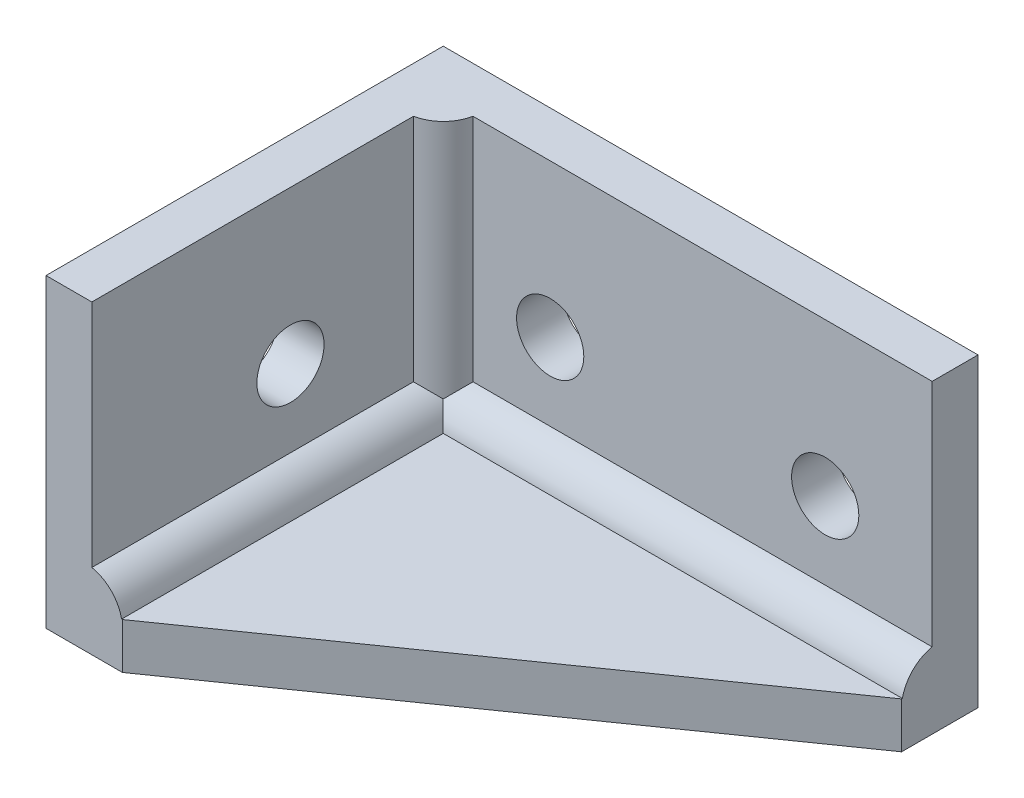
from build123d import *

# Parameters (mm, degrees)
BOSS_EXTRUDE1_DEPTH      = 20
CUT_EXTRUDE1_DEPTH       = 17
BOSS_EXTRUDE2_REACH      = 49.969
SKETCH3_R                = 2.5
BOSS_EXTRUDE3_REACH      = 49.969
BOSS_EXTRUDE3_END_RADIUS = 2.5
SKETCH4_R                = 2.5
BOSS_EXTRUDE4_REACH      = 49.969
SKETCH5_R                = 2.5
SKETCH6_R                = 2.2
CUT_EXTRUDE2_DEPTH       = 47.411205543
SKETCH7_R                = 2.2
CUT_EXTRUDE3_DEPTH       = 46.82575695


with BuildPart() as part:
    # Sketch1 → Boss-Extrude1 (new body)
    with BuildSketch(Plane(origin=(0, 0, 0), x_dir=(1, 0, 0), z_dir=(0, 1, 0))):
        Polygon((0, 0), (35, 0), (35, -5), (5, -26), (0, -26), align=None)
    extrude(amount=BOSS_EXTRUDE1_DEPTH)

    # Sketch2 → Cut-Extrude1 (cut)
    with BuildSketch(Plane(origin=(0, 20, 0), x_dir=(1, 0, 0), z_dir=(0, 1, 0))):
        Polygon((35, -3), (3, -3), (3, -26), (5, -26), (35, -5), align=None)
    extrude(amount=-CUT_EXTRUDE1_DEPTH, mode=Mode.SUBTRACT)

    # Sketch3 → Boss-Extrude2 (add, up to next)
    with BuildSketch(Plane.XY.offset(26), mode=Mode.PRIVATE) as boss_extrude2_sk1:
        with Locations((2.5, 2.5)):
            Circle(SKETCH3_R)
    boss_extrude2_tool1 = extrude(boss_extrude2_sk1.sketch, amount=-BOSS_EXTRUDE2_REACH, mode=Mode.PRIVATE) - part.part
    add(boss_extrude2_tool1.solids().sort_by_distance((2.5, 2.5, 26))[0])

    # Boss-Extrude3: up to this cylinder (the profile starts outside it)
    boss_extrude3_end = Plane(origin=(2.5, 2.5, 2.5), z_dir=(0, 0, 1)) * Cylinder(BOSS_EXTRUDE3_END_RADIUS, 105.938, mode=Mode.PRIVATE)
    # Sketch4 → Boss-Extrude3 (add, up to the surface)
    with BuildSketch(Plane(origin=(35, 0, 0), x_dir=(0, 0, -1), z_dir=(1, 0, 0)), mode=Mode.PRIVATE) as boss_extrude3_sk1:
        with Locations((-2.5, 2.5)):
            Circle(SKETCH4_R)
    boss_extrude3_tool1 = extrude(boss_extrude3_sk1.sketch, amount=-BOSS_EXTRUDE3_REACH, mode=Mode.PRIVATE) - boss_extrude3_end
    add(boss_extrude3_tool1.solids().sort_by_distance((35, 2.5, 2.5))[0])

    # Sketch5 → Boss-Extrude4 (add, up to next)
    with BuildSketch(Plane(origin=(0, 20, 0), x_dir=(1, 0, 0), z_dir=(0, 1, 0)), mode=Mode.PRIVATE) as boss_extrude4_sk1:
        with Locations((2.5, -2.5)):
            Circle(SKETCH5_R)
    boss_extrude4_tool1 = extrude(boss_extrude4_sk1.sketch, amount=-BOSS_EXTRUDE4_REACH, mode=Mode.PRIVATE) - part.part
    add(boss_extrude4_tool1.solids().sort_by_distance((2.5, 20, 2.5))[0])

    # Sketch6 → Cut-Extrude2 (cut, through all)
    with BuildSketch(Plane.XY.offset(3)):
        with Locations((10, 10)):
            Circle(SKETCH6_R)
        with Locations((28, 10)):
            Circle(SKETCH6_R)
    extrude(amount=-CUT_EXTRUDE2_DEPTH, mode=Mode.SUBTRACT)

    # Sketch7 → Cut-Extrude3 (cut, through all)
    with BuildSketch(Plane(origin=(3, 0, 0), x_dir=(0, 0, -1), z_dir=(1, 0, 0))):
        with Locations((-13, 10)):
            Circle(SKETCH7_R)
    extrude(amount=-CUT_EXTRUDE3_DEPTH, mode=Mode.SUBTRACT)


solid = part.part
